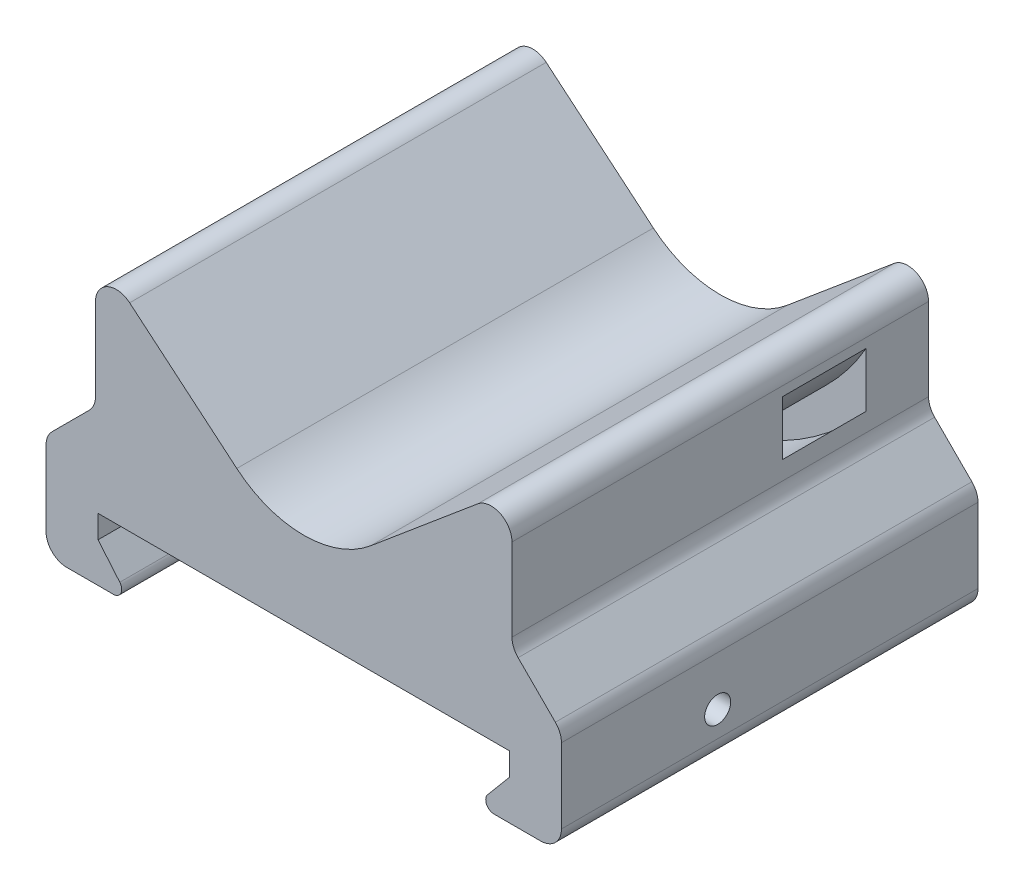
from build123d import *

# Parameters (mm, degrees)
BOSS_EXTRUDE1_DEPTH             = 40
SKETCH2_W                       = 8
SKETCH2_H                       = 3
M3X0_5_TAPPED_HOLE1_D           = 2.5
M3X0_5_TAPPED_HOLE1_CSINK_D     = 3.05
M3X0_5_TAPPED_HOLE1_CSINK_ANGLE = 90


with BuildPart() as part:
    # Sketch1 → Boss-Extrude1 (new body)
    with BuildSketch(Plane.XY):
        with BuildLine():
            Line((6.427876097, 10.393628462), (16.714424781, 19.025067669))
            ThreePointArc((16.714424781, 19.025067669), (18.845236523, 19.305594357), (20, 17.492978783))
            Line((20, 17.492978783), (20, 9.578427125))
            ThreePointArc((20, 9.578427125), (20.152240935, 8.81306026), (20.585786438, 8.164213562))
            Line((20.585786438, 8.164213562), (24.164213562, 4.585786438))
            ThreePointArc((24.164213562, 4.585786438), (24.597759065, 3.93693974), (24.75, 3.171572875))
            Line((24.75, 3.171572875), (24.75, -4))
            ThreePointArc((24.75, -4), (24.164213562, -5.414213562), (22.75, -6))
            Line((22.75, -6), (18.277026938, -6))
            ThreePointArc((18.277026938, -6), (17.551980708, -5.538094609), (17.664191383, -4.685769912))
            Line((17.664191383, -4.685769912), (19.75, -2.2))
            Line((19.75, -2.2), (19.75, 0))
            Line((19.75, 0), (-19.75, 0))
            Line((-19.75, 0), (-19.75, -2.2))
            Line((-19.75, -2.2), (-17.664191383, -4.685769912))
            ThreePointArc((-17.664191383, -4.685769912), (-17.551980708, -5.538094609), (-18.277026938, -6))
            Line((-18.277026938, -6), (-22.75, -6))
            ThreePointArc((-22.75, -6), (-24.164213562, -5.414213562), (-24.75, -4))
            Line((-24.75, -4), (-24.75, 3.171572875))
            ThreePointArc((-24.75, 3.171572875), (-24.597759065, 3.93693974), (-24.164213562, 4.585786438))
            Line((-24.164213562, 4.585786438), (-20.585786438, 8.164213562))
            ThreePointArc((-20.585786438, 8.164213562), (-20.152240935, 8.81306026), (-20, 9.578427125))
            Line((-20, 9.578427125), (-20, 17.492978783))
            ThreePointArc((-20, 17.492978783), (-18.845236523, 19.305594357), (-16.714424781, 19.025067669))
            Line((-16.714424781, 19.025067669), (-6.427876097, 10.393628462))
            ThreePointArc((-6.427876097, 10.393628462), (0, 8.054072893), (6.427876097, 10.393628462))
        make_face()
    extrude(amount=BOSS_EXTRUDE1_DEPTH)

    # Sketch2 → Cut-Revolve1 (revolve, cut)
    with BuildSketch(Plane(origin=(0, 0, 0), x_dir=(0, 0, -1), z_dir=(1, 0, 0))):
        with Locations((-10, 3.5)):
            Rectangle(SKETCH2_W, SKETCH2_H)
        with Locations((-50, 3.5)):
            Rectangle(SKETCH2_W, SKETCH2_H)
        with Locations((-90, 3.5)):
            Rectangle(SKETCH2_W, SKETCH2_H)
    revolve(axis=Axis((0, 28.054072893, 29.353848425), (0, 0, -1)), mode=Mode.SUBTRACT)

    # M3x0.5 Tapped Hole1 (through all)
    with Locations(Plane.ZY.offset(24.75)):
        with Locations((25, -1.555540573), (75, -1.555540573)):
            CounterSinkHole(M3X0_5_TAPPED_HOLE1_D / 2, M3X0_5_TAPPED_HOLE1_CSINK_D / 2, counter_sink_angle=M3X0_5_TAPPED_HOLE1_CSINK_ANGLE)


solid = part.part
